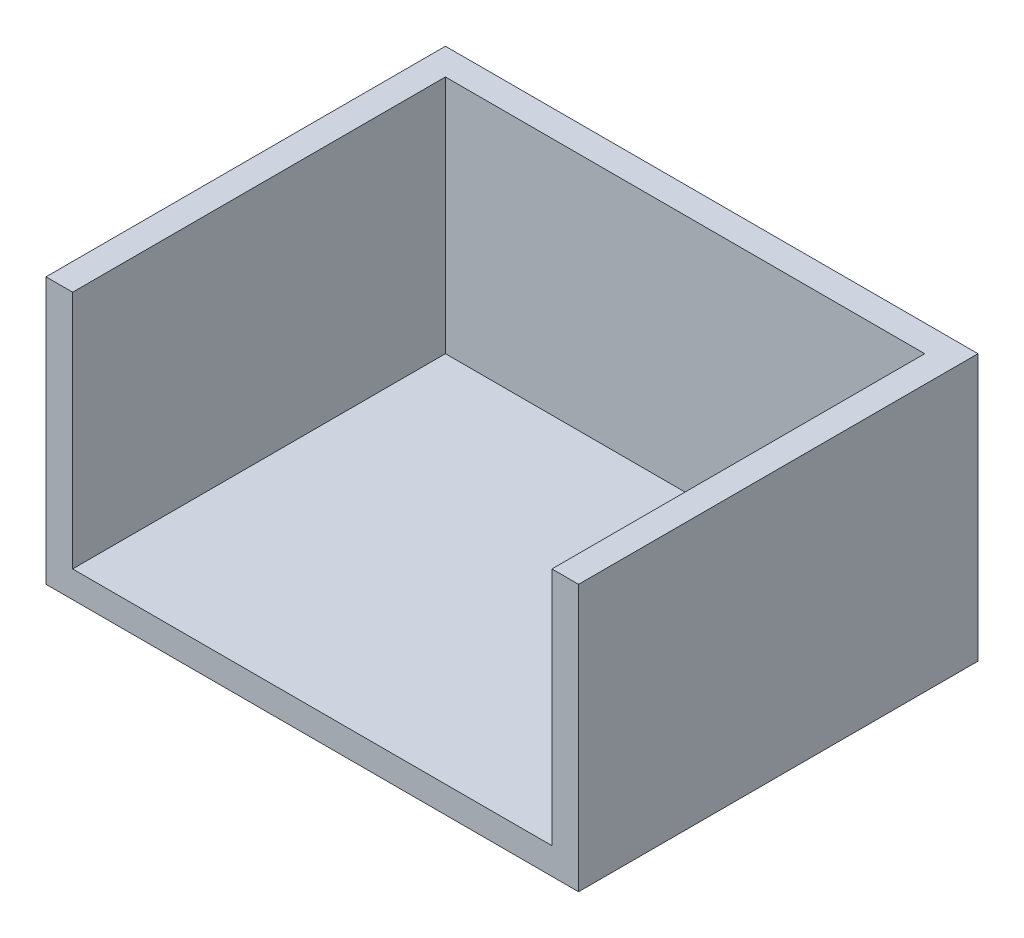
from build123d import *

# Parameters (mm, degrees)
SKETCH1_W           = 101.6
SKETCH1_H           = 76.2
BOSS_EXTRUDE1_DEPTH = 25.4
SHELL1_T            = -5.08


with BuildPart() as part:
    # Sketch1 → Boss-Extrude1 (new, symmetric)
    with BuildSketch(Plane(origin=(0, 0, 0), x_dir=(1, 0, 0), z_dir=(0, 1, 0))):
        Rectangle(SKETCH1_W, SKETCH1_H)
    extrude(amount=BOSS_EXTRUDE1_DEPTH, both=True)

    # Shell1
    shell1_openings = [part.faces().sort_by_distance(p)[0] for p in [
        (0, 25.4, 0),
        (0, 0, 38.1),
    ]]
    offset(amount=SHELL1_T, openings=shell1_openings, kind=Kind.INTERSECTION)


solid = part.part
